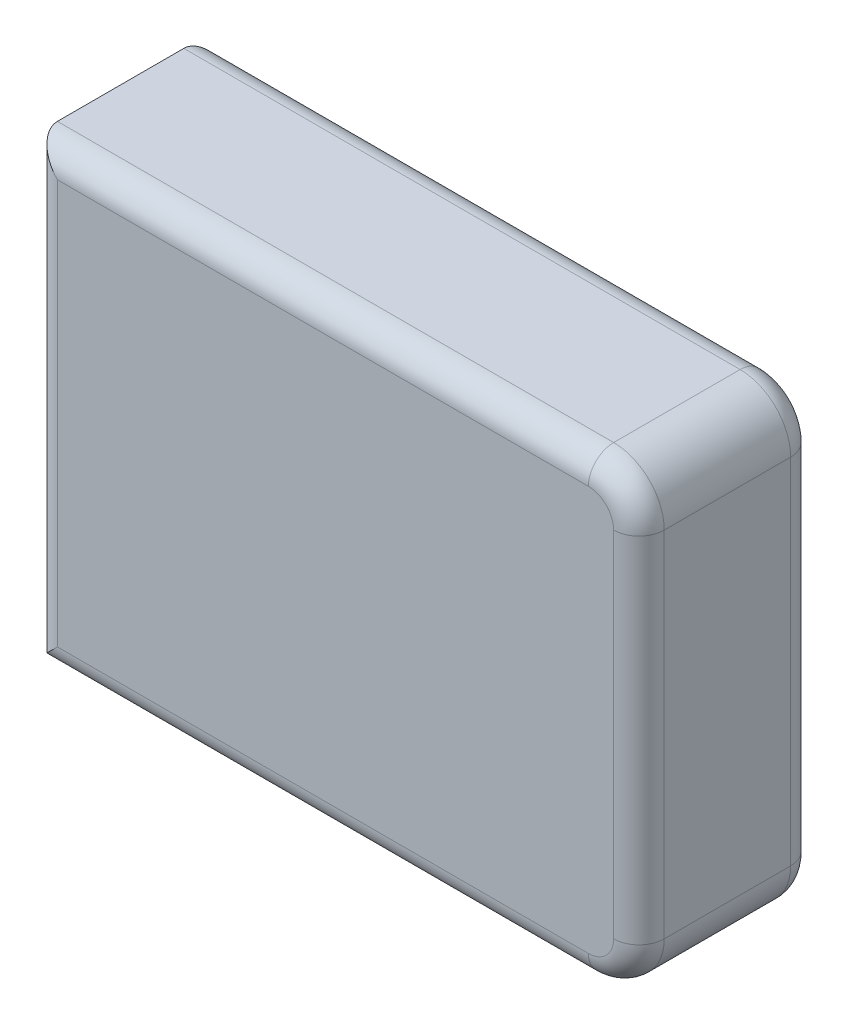
from build123d import *

# Parameters (mm, degrees)
SKETCH1_W           = 120
SKETCH1_H           = 90
BOSS_EXTRUDE1_DEPTH = 35
FILLET1_R           = 10
FILLET2_R           = 5


with BuildPart() as part:
    # Sketch1 → Boss-Extrude1 (new body)
    with BuildSketch(Plane.XY):
        Rectangle(SKETCH1_W, SKETCH1_H)
    extrude(amount=BOSS_EXTRUDE1_DEPTH)

    # Fillet1
    fillet1_edges = [part.edges().sort_by_distance(p)[0] for p in [
        (60, -45, 17.5),
        (60, 45, 17.5),
    ]]
    fillet(fillet1_edges, radius=FILLET1_R)

    # Fillet2
    fillet2_edges = [part.edges().sort_by_distance(p)[0] for p in [
        (-60, 0, 35),
        (-5, -45, 35),
        (60, 0, 0),
        (60, 0, 35),
        (-5, 45, 0),
        (57.071067812, 42.071067812, 0),
        (57.071067812, -42.071067812, 0),
        (-5, 45, 35),
        (57.071067812, 42.071067812, 35),
        (57.071067812, -42.071067812, 35),
        (-5, -45, 0),
        (-60, 0, 0),
    ]]
    fillet(fillet2_edges, radius=FILLET2_R)


solid = part.part
